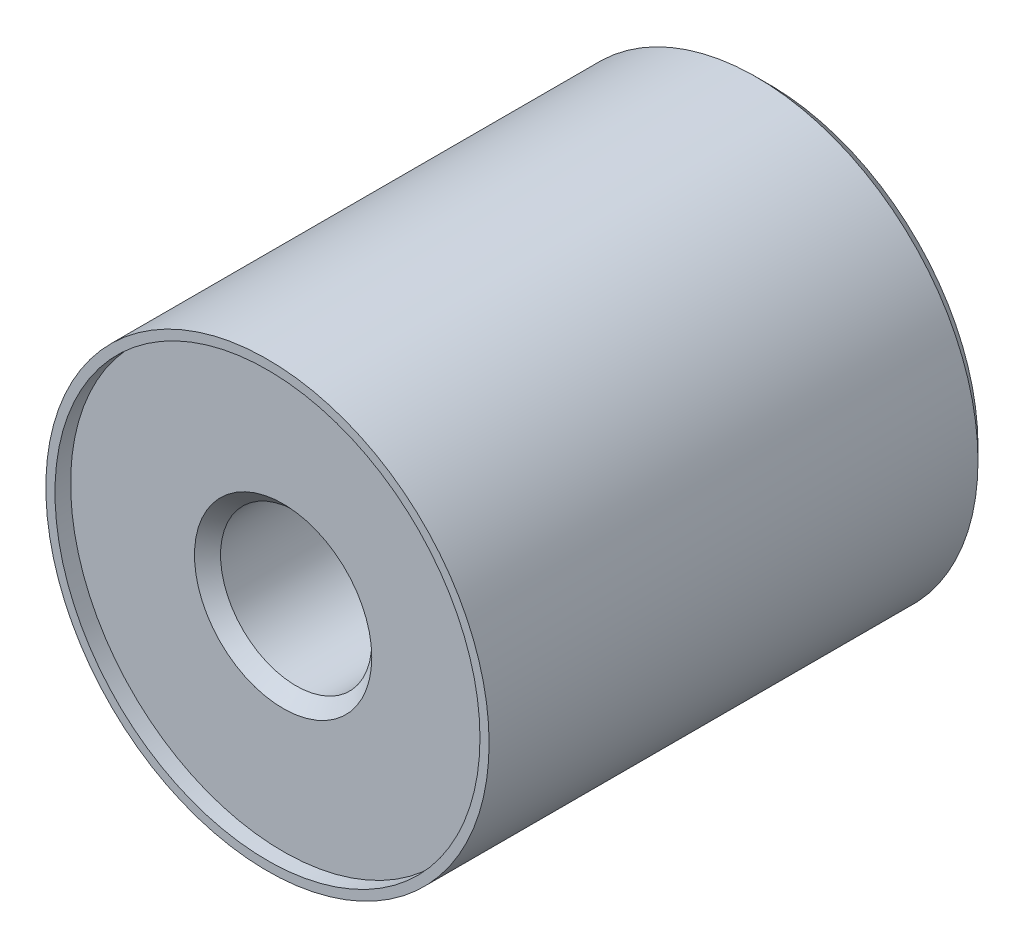
from build123d import *

# Parameters (mm, degrees)
SKIZZE1_R                       = 8.5
SKIZZE1_R_2                     = 2.9
AUFSATZ_LINEAR_AUSTRAGEN1_DEPTH = 18.65
SKIZZE2_R                       = 8.5
SKIZZE2_R_2                     = 8.15
AUFSATZ_LINEAR_AUSTRAGEN2_DEPTH = 0.6
FASE1_SIZE                      = 0.5


with BuildPart() as part:
    # Skizze1 → Aufsatz-Linear austragen1 (new body)
    with BuildSketch(Plane.XY):
        Circle(SKIZZE1_R)
        Circle(SKIZZE1_R_2, mode=Mode.SUBTRACT)
    extrude(amount=AUFSATZ_LINEAR_AUSTRAGEN1_DEPTH)

    # Skizze2 → Aufsatz-Linear austragen2 (add)
    with BuildSketch(Plane.XY.offset(18.65)):
        Circle(SKIZZE2_R)
        Circle(SKIZZE2_R_2, mode=Mode.SUBTRACT)
    extrude(amount=AUFSATZ_LINEAR_AUSTRAGEN2_DEPTH)

    # Fase1
    fase1_edges = [part.edges().sort_by_distance(p)[0] for p in [
        (-8.5, 0, 0),
        (-2.9, 0, 0),
        (-2.9, 0, 18.65),
    ]]
    chamfer(fase1_edges, length=FASE1_SIZE)


solid = part.part
